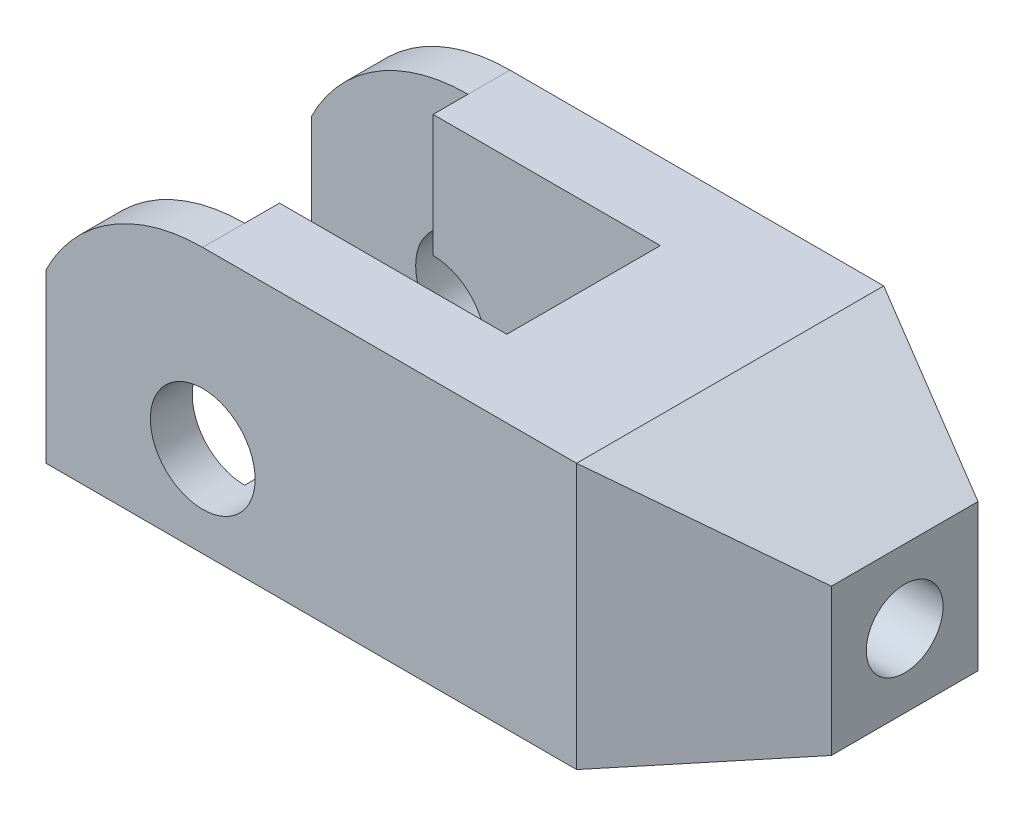
from build123d import *

# Parameters (mm, degrees)
SKETCH1_W               = 101
SKETCH1_H               = 38
BOSS_EXTRUDE1_DEPTH     = 22
CUT_EXTRUDE1_DEPTH      = 111.131739294
CUT_EXTRUDE1_DEPTH_BACK = 111.131739294
SKETCH2_R               = 7.5
CUT_EXTRUDE3_REACH      = 112.132
CUT_EXTRUDE4_REACH      = 112.132
SKETCH4_R               = 5.5


with BuildPart() as part:
    # Sketch1 → Boss-Extrude1 (new, symmetric)
    with BuildSketch(Plane.XY):
        with Locations((50.5, 19)):
            Rectangle(SKETCH1_W, SKETCH1_H)
    extrude(amount=BOSS_EXTRUDE1_DEPTH, both=True)

    # Sketch2 → Cut-Extrude1 (cut, two sides: drawn at the far end of the back side and taken through both)
    with BuildSketch(Plane.XY.offset(-CUT_EXTRUDE1_DEPTH_BACK)):
        with Locations((22.449944321, 13)):
            Circle(SKETCH2_R)
        Polygon((76, 38), (101, 29.5), (101, 38), align=None)
        Polygon((101, 0), (76, 0), (101, 8.5), align=None)
        with BuildLine():
            Line((22.449944321, 38), (0, 38))
            Line((0, 38), (0, 24))
            ThreePointArc((0, 24), (9.221187765, 34.213203436), (22.449944321, 38))
        make_face()
    extrude(amount=CUT_EXTRUDE1_DEPTH + CUT_EXTRUDE1_DEPTH_BACK, mode=Mode.SUBTRACT)

    # Sketch3 → Cut-Extrude3 (cut, up to next)
    with BuildSketch(Plane(origin=(0, 0, 0), x_dir=(1, 0, 0), z_dir=(0, 1, 0)), mode=Mode.PRIVATE) as cut_extrude3_sk1:
        Polygon((76, 22), (101, 10.5), (101, 22), align=None)
    cut_extrude3_tool1 = extrude(cut_extrude3_sk1.sketch, amount=CUT_EXTRUDE3_REACH, mode=Mode.PRIVATE) & part.part
    # Sketch3 → Cut-Extrude3 (cut, up to next)
    with BuildSketch(Plane(origin=(0, 0, 0), x_dir=(1, 0, 0), z_dir=(0, 1, 0)), mode=Mode.PRIVATE) as cut_extrude3_sk2:
        Polygon((101, -22), (76, -22), (101, -10.5), align=None)
    cut_extrude3_tool2 = extrude(cut_extrude3_sk2.sketch, amount=CUT_EXTRUDE3_REACH, mode=Mode.PRIVATE) & part.part
    # Sketch3 → Cut-Extrude3 (cut, up to next)
    with BuildSketch(Plane(origin=(0, 0, 0), x_dir=(1, 0, 0), z_dir=(0, 1, 0)), mode=Mode.PRIVATE) as cut_extrude3_sk3:
        Polygon((0, 16), (22.449944321, 16), (22.449944321, 11), (55, 11), (55, -11), (22.449944321, -11), (22.449944321, -16), (0, -16), align=None)
    cut_extrude3_tool3 = extrude(cut_extrude3_sk3.sketch, amount=CUT_EXTRUDE3_REACH, mode=Mode.PRIVATE) & part.part
    add(cut_extrude3_tool1.solids().sort_by_distance((92.666667, 0, -18.166667))[0], mode=Mode.SUBTRACT)
    add(cut_extrude3_tool2.solids().sort_by_distance((92.666667, 0, 18.166667))[0], mode=Mode.SUBTRACT)
    add(cut_extrude3_tool3.solids().sort_by_distance((24.952955, 0, 0))[0], mode=Mode.SUBTRACT)

    # Sketch4 → Cut-Extrude4 (cut, up to next)
    with BuildSketch(Plane(origin=(101, 0, 0), x_dir=(0, 0, -1), z_dir=(1, 0, 0)), mode=Mode.PRIVATE) as cut_extrude4_sk1:
        with Locations((0, 19)):
            Circle(SKETCH4_R)
    cut_extrude4_tool1 = extrude(cut_extrude4_sk1.sketch, amount=-CUT_EXTRUDE4_REACH, mode=Mode.PRIVATE) & part.part
    add(cut_extrude4_tool1.solids().sort_by_distance((101, 19, 0))[0], mode=Mode.SUBTRACT)


solid = part.part
